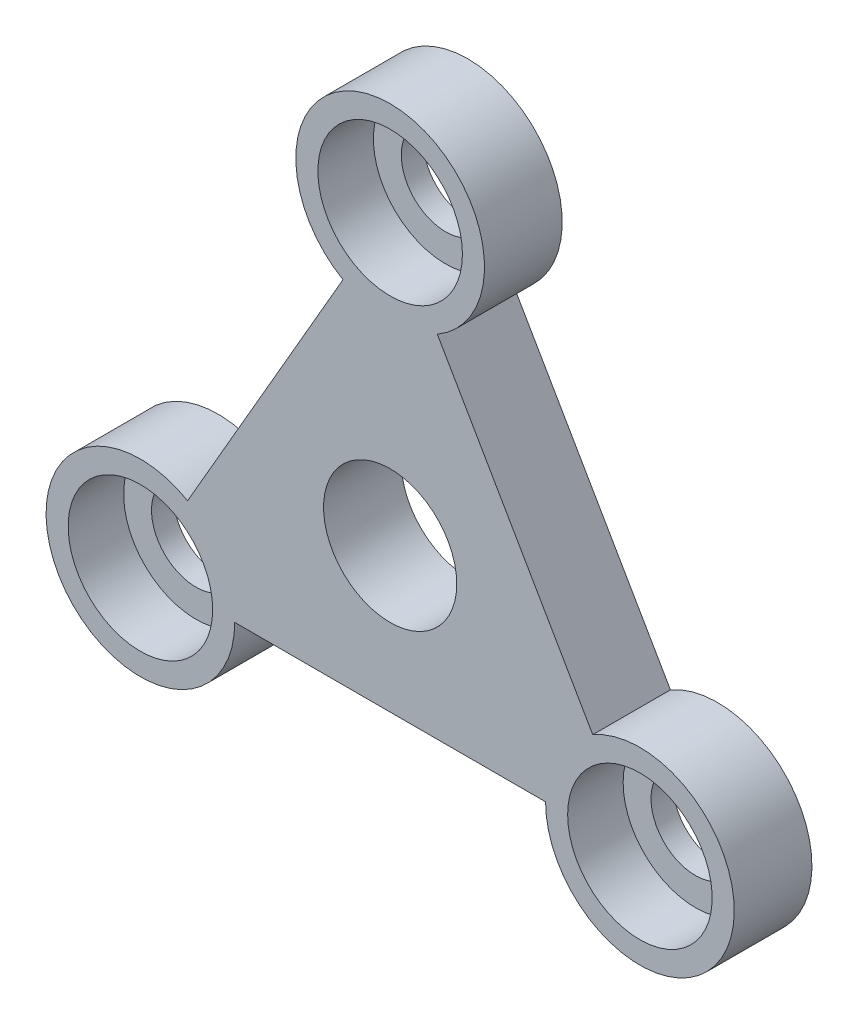
from build123d import *

# Parameters (mm, degrees)
BOSS_EXTRUDE1_DEPTH = 7
SKETCH2_R           = 8.5
BOSS_EXTRUDE2_DEPTH = 7
SKETCH3_R           = 6.51
CUT_EXTRUDE1_DEPTH  = 5
SKETCH4_R           = 4
CUT_EXTRUDE2_DEPTH  = 72.699089491
SKETCH5_R           = 6
CUT_EXTRUDE3_DEPTH  = 72.866260748


with BuildPart() as part:
    # Sketch1 → Boss-Extrude1 (new body)
    with BuildSketch(Plane.XY):
        Polygon((0, 0), (45, 0), (22.5, 38.97114317), align=None)
    extrude(amount=BOSS_EXTRUDE1_DEPTH)

    # Sketch2 → Boss-Extrude2 (add)
    with BuildSketch(Plane.XY.offset(7)):
        Circle(SKETCH2_R)
        with Locations((45, 0)):
            Circle(SKETCH2_R)
        with Locations((22.5, 38.97114317)):
            Circle(SKETCH2_R)
    extrude(amount=-BOSS_EXTRUDE2_DEPTH)

    # Sketch3 → Cut-Extrude1 (cut)
    with BuildSketch(Plane.XY.offset(7)):
        Circle(SKETCH3_R)
        with Locations(Location((45, 0, 0), (0, 0, 180))):
            Circle(SKETCH3_R)
        with Locations((22.5, 38.97114317)):
            Circle(SKETCH3_R)
    extrude(amount=-CUT_EXTRUDE1_DEPTH, mode=Mode.SUBTRACT)

    # Sketch4 → Cut-Extrude2 (cut, through all)
    with BuildSketch(Plane.XY.offset(2)):
        Circle(SKETCH4_R)
        with Locations(Location((45, 0, 0), (0, 0, 180))):
            Circle(SKETCH4_R)
        with Locations((22.5, 38.97114317)):
            Circle(SKETCH4_R)
    extrude(amount=-CUT_EXTRUDE2_DEPTH, mode=Mode.SUBTRACT)

    # Sketch5 → Cut-Extrude3 (cut, through all)
    with BuildSketch(Plane.XY.offset(7)):
        with Locations((22.5, 12.990381057)):
            Circle(SKETCH5_R)
    extrude(amount=-CUT_EXTRUDE3_DEPTH, mode=Mode.SUBTRACT)


solid = part.part
